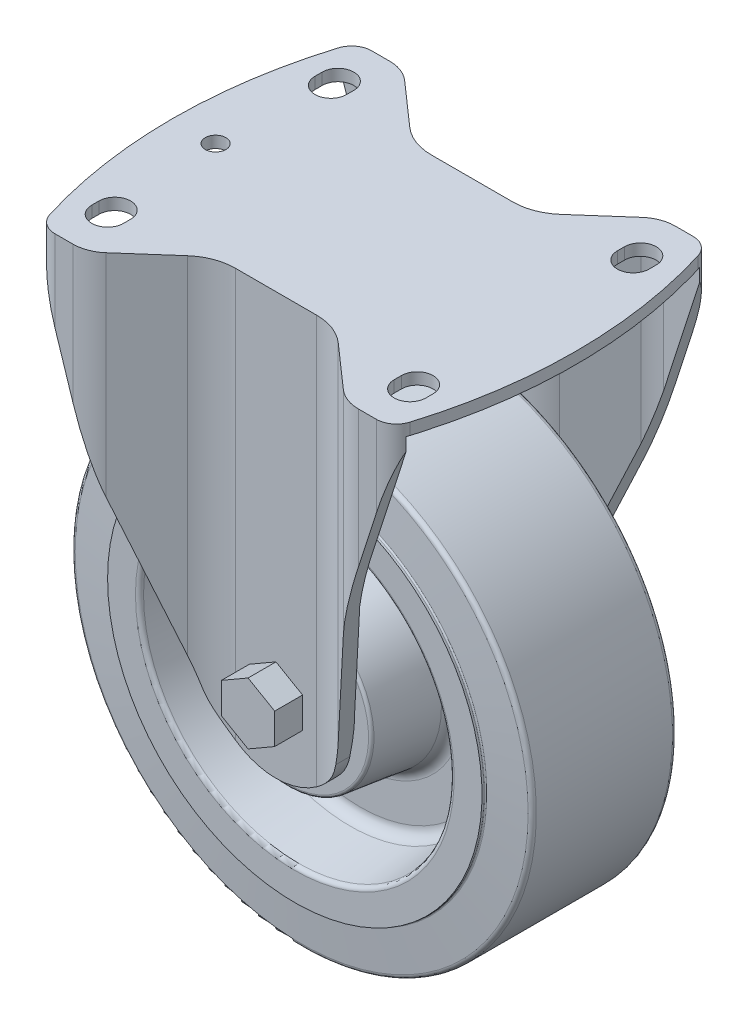
from build123d import *

# Parameters (mm, degrees)
SKETCH1_R               = 3.586265448
BOSS_EXTRUDE1_DEPTH     = 202
CUT_EXTRUDE1_DEPTH      = 197.974
CUT_EXTRUDE2_DEPTH      = 110
CUT_EXTRUDE2_DEPTH_BACK = 110
CUT_EXTRUDE3_DEPTH      = 65
CUT_EXTRUDE4_DEPTH      = 65
CUT_EXTRUDE5_DEPTH      = 65
CUT_EXTRUDE6_DEPTH      = 65
BOSS_EXTRUDE2_DEPTH     = 9.68
BOSS_EXTRUDE3_DEPTH     = 9.68


with BuildPart() as part:
    # Sketch1 → Boss-Extrude1 (new body)
    with BuildSketch(Plane(origin=(0, 122, 0), x_dir=(1, 0, 0), z_dir=(0, 1, 0))):
        with BuildLine():
            Line((-55.787779328, -55), (-49.556456596, -55))
            ThreePointArc((-49.556456596, -55), (-45.106510604, -54.188043971), (-41.230082148, -51.856822328))
            Line((-41.230082148, -51.856822328), (-26.156548009, -38.585145526))
            ThreePointArc((-26.156548009, -38.585145526), (-20.557262461, -35.217825375), (-14.129562694, -34.045))
            Line((-14.129562694, -34.045), (14.129562694, -34.045))
            ThreePointArc((14.129562694, -34.045), (20.557262461, -35.217825375), (26.156548009, -38.585145526))
            Line((26.156548009, -38.585145526), (41.230082148, -51.856822328))
            ThreePointArc((41.230082148, -51.856822328), (45.106510604, -54.188043971), (49.556456596, -55))
            Line((49.556456596, -55), (55.787779328, -55))
            ThreePointArc((55.787779328, -55), (59.947115028, -53.63026878), (62.47868731, -50.057121866))
            ThreePointArc((62.47868731, -50.057121866), (70, 0), (62.47868731, 50.057121866))
            ThreePointArc((62.47868731, 50.057121866), (59.947115028, 53.63026878), (55.787779328, 55))
            Line((55.787779328, 55), (49.556456596, 55))
            ThreePointArc((49.556456596, 55), (45.106510604, 54.188043971), (41.230082148, 51.856822328))
            Line((41.230082148, 51.856822328), (26.156548009, 38.585145526))
            ThreePointArc((26.156548009, 38.585145526), (20.557262461, 35.217825375), (14.129562694, 34.045))
            Line((14.129562694, 34.045), (-14.129562694, 34.045))
            ThreePointArc((-14.129562694, 34.045), (-20.557262461, 35.217825375), (-26.156548009, 38.585145526))
            Line((-26.156548009, 38.585145526), (-41.230082148, 51.856822328))
            ThreePointArc((-41.230082148, 51.856822328), (-45.106510604, 54.188043971), (-49.556456596, 55))
            Line((-49.556456596, 55), (-55.787779328, 55))
            ThreePointArc((-55.787779328, 55), (-59.947115028, 53.63026878), (-62.47868731, 50.057121866))
            ThreePointArc((-62.47868731, 50.057121866), (-70, 0), (-62.47868731, -50.057121866))
            ThreePointArc((-62.47868731, -50.057121866), (-59.947115028, -53.63026878), (-55.787779328, -55))
        make_face()
        with Locations(Location((-55, 0, 0), (0, 0, 270))):
            Circle(SKETCH1_R, mode=Mode.SUBTRACT)
    extrude(amount=-BOSS_EXTRUDE1_DEPTH)

    # Sketch2 → Cut-Extrude1 (cut)
    with BuildSketch(Plane(origin=(0, -80.01, 0), x_dir=(1, 0, 0), z_dir=(0, 1, 0))):
        with BuildLine():
            Line((-93.333333333, -50.974), (-49.556456596, -50.974))
            ThreePointArc((-49.556456596, -50.974), (-46.593091052, -50.250046586), (-43.890557031, -48.835142432))
            Line((-43.890557031, -48.835142432), (-28.817022892, -35.56346563))
            ThreePointArc((-28.817022892, -35.56346563), (-22.101850424, -31.126164294), (-14.129562694, -30.019))
            Line((-14.129562694, -30.019), (14.129562694, -30.019))
            ThreePointArc((14.129562694, -30.019), (22.101850424, -31.126164294), (28.817022892, -35.56346563))
            Line((28.817022892, -35.56346563), (43.890557031, -48.835142432))
            ThreePointArc((43.890557031, -48.835142432), (46.593091052, -50.250046586), (49.556456596, -50.974))
            Line((49.556456596, -50.974), (93.333333333, -50.974))
            Line((93.333333333, -50.974), (93.333333333, 50.974))
            Line((93.333333333, 50.974), (49.556456596, 50.974))
            ThreePointArc((49.556456596, 50.974), (46.593091052, 50.250046586), (43.890557031, 48.835142432))
            Line((43.890557031, 48.835142432), (28.817022892, 35.56346563))
            ThreePointArc((28.817022892, 35.56346563), (22.101850424, 31.126164294), (14.129562694, 30.019))
            Line((14.129562694, 30.019), (-14.129562694, 30.019))
            ThreePointArc((-14.129562694, 30.019), (-22.101850424, 31.126164294), (-28.817022892, 35.56346563))
            Line((-28.817022892, 35.56346563), (-43.890557031, 48.835142432))
            ThreePointArc((-43.890557031, 48.835142432), (-46.593091052, 50.250046586), (-49.556456596, 50.974))
            Line((-49.556456596, 50.974), (-93.333333333, 50.974))
            Line((-93.333333333, 50.974), (-93.333333333, -50.974))
        make_face()
    extrude(amount=CUT_EXTRUDE1_DEPTH, mode=Mode.SUBTRACT)

    # Sketch3 → Cut-Extrude2 (cut, two sides: drawn at the far end of the back side and taken through both)
    with BuildSketch(Plane.XY.offset(-CUT_EXTRUDE2_DEPTH_BACK)):
        with BuildLine():
            Line((-85.555555556, -81), (85.555555556, -81))
            Line((85.555555556, -81), (85.555555556, 117.974))
            Line((85.555555556, 117.974), (63.592726887, 117.974))
            Line((63.592726887, 117.974), (23.172712673, -7.466800077))
            ThreePointArc((23.172712673, -7.466800077), (0, -24.346), (-23.172712673, -7.466800077))
            Line((-23.172712673, -7.466800077), (-63.592726887, 117.974))
            Line((-63.592726887, 117.974), (-85.555555556, 117.974))
            Line((-85.555555556, 117.974), (-85.555555556, -81))
        make_face()
    extrude(amount=CUT_EXTRUDE2_DEPTH + CUT_EXTRUDE2_DEPTH_BACK, mode=Mode.SUBTRACT)

    # Sketch4 → Cut-Extrude3 (cut)
    with BuildSketch(Plane(origin=(0, 122, 0), x_dir=(1, 0, 0), z_dir=(0, 1, 0))):
        with BuildLine():
            Line((58, 37.5), (58, 40))
            ThreePointArc((58, 40), (52.5, 45.5), (47, 40))
            Line((47, 40), (47, 37.5))
            ThreePointArc((47, 37.5), (52.5, 32), (58, 37.5))
        make_face()
    extrude(amount=-CUT_EXTRUDE3_DEPTH, mode=Mode.SUBTRACT)

    # Sketch5 → Cut-Extrude4 (cut)
    with BuildSketch(Plane(origin=(0, 122, 0), x_dir=(1, 0, 0), z_dir=(0, 1, 0))):
        with BuildLine():
            Line((47, -37.5), (47, -40))
            ThreePointArc((47, -40), (52.5, -45.5), (58, -40))
            Line((58, -40), (58, -37.5))
            ThreePointArc((58, -37.5), (52.5, -32), (47, -37.5))
        make_face()
    extrude(amount=-CUT_EXTRUDE4_DEPTH, mode=Mode.SUBTRACT)

    # Sketch6 → Cut-Extrude5 (cut)
    with BuildSketch(Plane(origin=(0, 122, 0), x_dir=(1, 0, 0), z_dir=(0, 1, 0))):
        with BuildLine():
            Line((-47, 37.5), (-47, 40))
            ThreePointArc((-47, 40), (-52.5, 45.5), (-58, 40))
            Line((-58, 40), (-58, 37.5))
            ThreePointArc((-58, 37.5), (-52.5, 32), (-47, 37.5))
        make_face()
    extrude(amount=-CUT_EXTRUDE5_DEPTH, mode=Mode.SUBTRACT)

    # Sketch7 → Cut-Extrude6 (cut)
    with BuildSketch(Plane(origin=(0, 122, 0), x_dir=(1, 0, 0), z_dir=(0, 1, 0))):
        with BuildLine():
            Line((-58, -37.5), (-58, -40))
            ThreePointArc((-58, -40), (-52.5, -45.5), (-47, -40))
            Line((-47, -40), (-47, -37.5))
            ThreePointArc((-47, -37.5), (-52.5, -32), (-58, -37.5))
        make_face()
    extrude(amount=-CUT_EXTRUDE6_DEPTH, mode=Mode.SUBTRACT)

    # Sketch8 → Revolve1 (revolve)
    with BuildSketch(Plane(origin=(0, 0, 0), x_dir=(0, 0, -1), z_dir=(1, 0, 0)), mode=Mode.PRIVATE) as revolve1_sk:
        Polygon((-33.55, 0), (-33.55, 11.5), (-31, 11.5), (-31, 10), (31, 10), (31, 11.5), (33.55, 11.5), (33.55, 0), align=None)
    revolve(revolve1_sk.sketch.rotate(Axis((0, 0, -33.55), (0, 0, 1)), 90), axis=Axis((0, 0, -33.55), (0, 0, 1)))

    # Sketch9 → Boss-Extrude2 (add)
    with BuildSketch(Plane.XY.offset(43.725)):
        Polygon((-9.24, -5.334716487), (0, -10.669432975), (9.24, -5.334716487), (9.24, 5.334716487), (0, 10.669432975), (-9.24, 5.334716487), align=None)
    extrude(amount=-BOSS_EXTRUDE2_DEPTH)

    # Sketch10 → Boss-Extrude3 (add)
    with BuildSketch(Plane.XY.offset(-43.725)):
        Polygon((-9.24, -5.334716487), (0, -10.669432975), (9.24, -5.334716487), (9.24, 5.334716487), (0, 10.669432975), (-9.24, 5.334716487), align=None)
    extrude(amount=BOSS_EXTRUDE3_DEPTH)

    # Sketch11 → Revolve2 (revolve)
    with BuildSketch(Plane(origin=(0, 0, 0), x_dir=(0, 0, -1), z_dir=(1, 0, 0)), mode=Mode.PRIVATE) as revolve2_sk:
        with BuildLine():
            Line((-30, 28.115274735), (-30, 9))
            Line((-30, 9), (30, 9))
            Line((30, 9), (30, 28.115274735))
            ThreePointArc((30, 28.115274735), (29.748955721, 28.777894784), (29.121869343, 29.107820887))
            Line((29.121869343, 29.107820887), (8.262522626, 31.669026614))
            ThreePointArc((8.262522626, 31.669026614), (5.754177117, 32.988731028), (4.75, 35.639211221))
            Line((4.75, 35.639211221), (4.75, 47.667750181))
            ThreePointArc((4.75, 47.667750181), (5.754177117, 50.318230374), (8.262522626, 51.637934788))
            Line((8.262522626, 51.637934788), (26.182804015, 53.838268669))
            ThreePointArc((26.182804015, 53.838268669), (27.123433581, 54.333157825), (27.5, 55.327087897))
            Line((27.5, 55.327087897), (27.5, 65))
            Line((27.5, 65), (26.77049554, 65))
            ThreePointArc((26.77049554, 65), (26.432700436, 65.131361332), (26.272398191, 65.456422129))
            Line((26.272398191, 65.456422129), (25.119795286, 78.630733614))
            ThreePointArc((25.119795286, 78.630733614), (24.63888855, 79.605916005), (23.625503239, 80))
            Line((23.625503239, 80), (-23.625503239, 80))
            ThreePointArc((-23.625503239, 80), (-24.63888855, 79.605916005), (-25.119795286, 78.630733614))
            Line((-25.119795286, 78.630733614), (-26.272398191, 65.456422129))
            ThreePointArc((-26.272398191, 65.456422129), (-26.432700436, 65.131361332), (-26.77049554, 65))
            Line((-26.77049554, 65), (-27.5, 65))
            Line((-27.5, 65), (-27.5, 55.327087897))
            ThreePointArc((-27.5, 55.327087897), (-27.123433581, 54.333157825), (-26.182804015, 53.838268669))
            Line((-26.182804015, 53.838268669), (-8.262522626, 51.637934788))
            ThreePointArc((-8.262522626, 51.637934788), (-5.754177117, 50.318230374), (-4.75, 47.667750181))
            Line((-4.75, 47.667750181), (-4.75, 35.639211221))
            ThreePointArc((-4.75, 35.639211221), (-5.754177117, 32.988731028), (-8.262522626, 31.669026614))
            Line((-8.262522626, 31.669026614), (-29.121869343, 29.107820887))
            ThreePointArc((-29.121869343, 29.107820887), (-29.748955721, 28.777894784), (-30, 28.115274735))
        make_face()
    revolve(revolve2_sk.sketch.rotate(Axis((0, 0, -30), (0, 0, 1)), 90), axis=Axis((0, 0, -30), (0, 0, 1)))


solid = part.part
